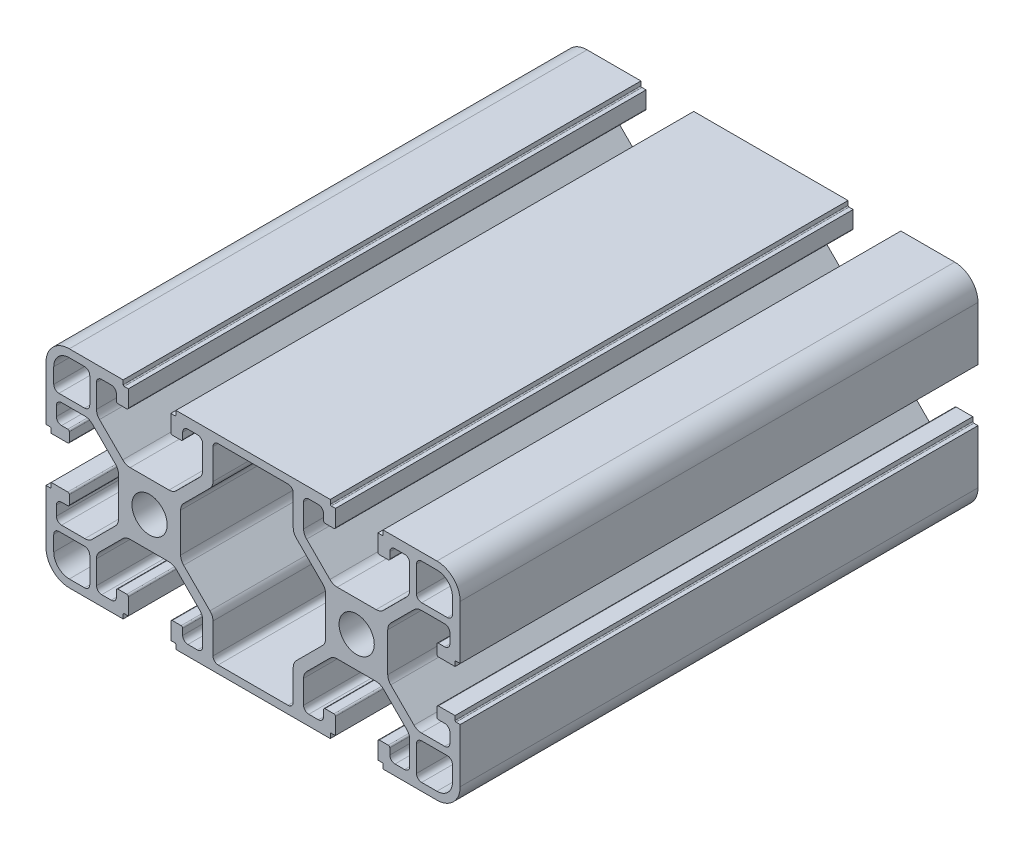
from build123d import *

# Parameters (mm, degrees)
SKETCH_1_R      = 3.4
EXTRUDE_1_DEPTH = 100


with BuildPart() as part:
    # 草图1 → 凸台-拉伸1 (new body)
    with BuildSketch(Plane.XY):
        with BuildLine():
            Line((-24.068782805, 18.940182328), (-34.468782805, 18.940182328))
            ThreePointArc((-34.468782805, 18.940182328), (-37.65076332, 17.622162844), (-38.968782805, 14.440182328))
            Line((-38.968782805, 14.440182328), (-38.968782805, 4.040182328))
            Line((-38.968782805, 4.040182328), (-38.168782805, 4.040182328))
            ThreePointArc((-38.168782805, 4.040182328), (-38.027361449, 3.981603684), (-37.968782805, 3.840182328))
            Line((-37.968782805, 3.840182328), (-37.968782805, 3.040182328))
            Line((-37.968782805, 3.040182328), (-34.768782805, 3.040182328))
            ThreePointArc((-34.768782805, 3.040182328), (-34.556650771, 3.128050294), (-34.468782805, 3.340182328))
            Line((-34.468782805, 3.340182328), (-34.468782805, 5.040182328))
            ThreePointArc((-34.468782805, 5.040182328), (-34.556650771, 5.252314363), (-34.768782805, 5.340182328))
            Line((-34.768782805, 5.340182328), (-35.968782805, 5.340182328))
            ThreePointArc((-35.968782805, 5.340182328), (-36.675889586, 5.633075547), (-36.968782805, 6.340182328))
            Line((-36.968782805, 6.340182328), (-36.968782805, 8.190182328))
            ThreePointArc((-36.968782805, 8.190182328), (-36.675889586, 8.897289109), (-35.968782805, 9.190182328))
            Line((-35.968782805, 9.190182328), (-31.461423492, 9.190182328))
            ThreePointArc((-31.461423492, 9.190182328), (-30.696056627, 9.037941393), (-30.04720993, 8.604395891))
            Line((-30.04720993, 8.604395891), (-25.554569243, 4.111755203))
            ThreePointArc((-25.554569243, 4.111755203), (-25.12102374, 3.462908506), (-24.968782805, 2.697541641))
            Line((-24.968782805, 2.697541641), (-24.968782805, -4.817176985))
            ThreePointArc((-24.968782805, -4.817176985), (-25.12102374, -5.582543849), (-25.554569243, -6.231390547))
            Line((-25.554569243, -6.231390547), (-30.04720993, -10.724031234))
            ThreePointArc((-30.04720993, -10.724031234), (-30.696056627, -11.157576737), (-31.461423492, -11.309817672))
            Line((-31.461423492, -11.309817672), (-35.968782805, -11.309817672))
            ThreePointArc((-35.968782805, -11.309817672), (-36.675889586, -11.016924453), (-36.968782805, -10.309817672))
            Line((-36.968782805, -10.309817672), (-36.968782805, -8.459817672))
            ThreePointArc((-36.968782805, -8.459817672), (-36.675889586, -7.752710891), (-35.968782805, -7.459817672))
            Line((-35.968782805, -7.459817672), (-34.768782805, -7.459817672))
            ThreePointArc((-34.768782805, -7.459817672), (-34.556650771, -7.371949706), (-34.468782805, -7.159817672))
            Line((-34.468782805, -7.159817672), (-34.468782805, -5.459817672))
            ThreePointArc((-34.468782805, -5.459817672), (-34.556650771, -5.247685637), (-34.768782805, -5.159817672))
            Line((-34.768782805, -5.159817672), (-37.968782805, -5.159817672))
            Line((-37.968782805, -5.159817672), (-37.968782805, -5.959817672))
            ThreePointArc((-37.968782805, -5.959817672), (-38.027361449, -6.101239028), (-38.168782805, -6.159817672))
            Line((-38.168782805, -6.159817672), (-38.968782805, -6.159817672))
            Line((-38.968782805, -6.159817672), (-38.968782805, -16.559817672))
            ThreePointArc((-38.968782805, -16.559817672), (-37.65076332, -19.741798187), (-34.468782805, -21.059817672))
            Line((-34.468782805, -21.059817672), (-24.068782805, -21.059817672))
            Line((-24.068782805, -21.059817672), (-24.068782805, -20.259817672))
            ThreePointArc((-24.068782805, -20.259817672), (-24.010204161, -20.118396316), (-23.868782805, -20.059817672))
            Line((-23.868782805, -20.059817672), (-23.068782805, -20.059817672))
            Line((-23.068782805, -20.059817672), (-23.068782805, -16.859817672))
            ThreePointArc((-23.068782805, -16.859817672), (-23.156650771, -16.647685637), (-23.368782805, -16.559817672))
            Line((-23.368782805, -16.559817672), (-25.068782805, -16.559817672))
            ThreePointArc((-25.068782805, -16.559817672), (-25.280914839, -16.647685637), (-25.368782805, -16.859817672))
            Line((-25.368782805, -16.859817672), (-25.368782805, -18.059817672))
            ThreePointArc((-25.368782805, -18.059817672), (-25.661676024, -18.766924453), (-26.368782805, -19.059817672))
            Line((-26.368782805, -19.059817672), (-28.218782805, -19.059817672))
            ThreePointArc((-28.218782805, -19.059817672), (-28.925889586, -18.766924453), (-29.218782805, -18.059817672))
            Line((-29.218782805, -18.059817672), (-29.218782805, -13.552458359))
            ThreePointArc((-29.218782805, -13.552458359), (-29.06654187, -12.787091494), (-28.632996367, -12.138244797))
            Line((-28.632996367, -12.138244797), (-24.14035568, -7.645604109))
            ThreePointArc((-24.14035568, -7.645604109), (-23.491508983, -7.212058607), (-22.726142118, -7.059817672))
            Line((-22.726142118, -7.059817672), (-15.211423492, -7.059817672))
            ThreePointArc((-15.211423492, -7.059817672), (-14.446056627, -7.212058607), (-13.79720993, -7.645604109))
            Line((-13.79720993, -7.645604109), (-9.304569243, -12.138244797))
            ThreePointArc((-9.304569243, -12.138244797), (-8.87102374, -12.787091494), (-8.718782805, -13.552458359))
            Line((-8.718782805, -13.552458359), (-8.718782805, -18.059817672))
            ThreePointArc((-8.718782805, -18.059817672), (-9.011676024, -18.766924453), (-9.718782805, -19.059817672))
            Line((-9.718782805, -19.059817672), (-11.568782805, -19.059817672))
            ThreePointArc((-11.568782805, -19.059817672), (-12.275889586, -18.766924453), (-12.568782805, -18.059817672))
            Line((-12.568782805, -18.059817672), (-12.568782805, -16.859817672))
            ThreePointArc((-12.568782805, -16.859817672), (-12.656650771, -16.647685637), (-12.868782805, -16.559817672))
            Line((-12.868782805, -16.559817672), (-14.568782805, -16.559817672))
            ThreePointArc((-14.568782805, -16.559817672), (-14.780914839, -16.647685637), (-14.868782805, -16.859817672))
            Line((-14.868782805, -16.859817672), (-14.868782805, -20.059817672))
            Line((-14.868782805, -20.059817672), (-14.068782805, -20.059817672))
            ThreePointArc((-14.068782805, -20.059817672), (-13.927361449, -20.118396316), (-13.868782805, -20.259817672))
            Line((-13.868782805, -20.259817672), (-13.868782805, -21.059817672))
            Line((-13.868782805, -21.059817672), (-3.468782805, -21.059817672))
            Line((-3.468782805, -21.059817672), (5.531217195, -21.059817672))
            Line((5.531217195, -21.059817672), (15.931217195, -21.059817672))
            Line((15.931217195, -21.059817672), (15.931217195, -20.259817672))
            ThreePointArc((15.931217195, -20.259817672), (15.989795839, -20.118396316), (16.131217195, -20.059817672))
            Line((16.131217195, -20.059817672), (16.931217195, -20.059817672))
            Line((16.931217195, -20.059817672), (16.931217195, -16.859817672))
            ThreePointArc((16.931217195, -16.859817672), (16.843349229, -16.647685637), (16.631217195, -16.559817672))
            Line((16.631217195, -16.559817672), (14.931217195, -16.559817672))
            ThreePointArc((14.931217195, -16.559817672), (14.719085161, -16.647685637), (14.631217195, -16.859817672))
            Line((14.631217195, -16.859817672), (14.631217195, -18.059817672))
            ThreePointArc((14.631217195, -18.059817672), (14.338323976, -18.766924453), (13.631217195, -19.059817672))
            Line((13.631217195, -19.059817672), (11.781217195, -19.059817672))
            ThreePointArc((11.781217195, -19.059817672), (11.074110414, -18.766924453), (10.781217195, -18.059817672))
            Line((10.781217195, -18.059817672), (10.781217195, -13.552458359))
            ThreePointArc((10.781217195, -13.552458359), (10.93345813, -12.787091494), (11.367003633, -12.138244797))
            Line((11.367003633, -12.138244797), (15.85964432, -7.645604109))
            ThreePointArc((15.85964432, -7.645604109), (16.508491017, -7.212058607), (17.273857882, -7.059817672))
            Line((17.273857882, -7.059817672), (24.788576508, -7.059817672))
            ThreePointArc((24.788576508, -7.059817672), (25.553943373, -7.212058607), (26.20279007, -7.645604109))
            Line((26.20279007, -7.645604109), (30.695430757, -12.138244797))
            ThreePointArc((30.695430757, -12.138244797), (31.12897626, -12.787091494), (31.281217195, -13.552458359))
            Line((31.281217195, -13.552458359), (31.281217195, -18.059817672))
            ThreePointArc((31.281217195, -18.059817672), (30.988323976, -18.766924453), (30.281217195, -19.059817672))
            Line((30.281217195, -19.059817672), (28.431217195, -19.059817672))
            ThreePointArc((28.431217195, -19.059817672), (27.724110414, -18.766924453), (27.431217195, -18.059817672))
            Line((27.431217195, -18.059817672), (27.431217195, -16.859817672))
            ThreePointArc((27.431217195, -16.859817672), (27.343349229, -16.647685637), (27.131217195, -16.559817672))
            Line((27.131217195, -16.559817672), (25.431217195, -16.559817672))
            ThreePointArc((25.431217195, -16.559817672), (25.219085161, -16.647685637), (25.131217195, -16.859817672))
            Line((25.131217195, -16.859817672), (25.131217195, -20.059817672))
            Line((25.131217195, -20.059817672), (25.931217195, -20.059817672))
            ThreePointArc((25.931217195, -20.059817672), (26.072638551, -20.118396316), (26.131217195, -20.259817672))
            Line((26.131217195, -20.259817672), (26.131217195, -21.059817672))
            Line((26.131217195, -21.059817672), (36.531217195, -21.059817672))
            ThreePointArc((36.531217195, -21.059817672), (39.71319771, -19.741798187), (41.031217195, -16.559817672))
            Line((41.031217195, -16.559817672), (41.031217195, -6.159817672))
            Line((41.031217195, -6.159817672), (40.231217195, -6.159817672))
            ThreePointArc((40.231217195, -6.159817672), (40.089795839, -6.101239028), (40.031217195, -5.959817672))
            Line((40.031217195, -5.959817672), (40.031217195, -5.159817672))
            Line((40.031217195, -5.159817672), (36.831217195, -5.159817672))
            ThreePointArc((36.831217195, -5.159817672), (36.619085161, -5.247685637), (36.531217195, -5.459817672))
            Line((36.531217195, -5.459817672), (36.531217195, -7.159817672))
            ThreePointArc((36.531217195, -7.159817672), (36.619085161, -7.371949706), (36.831217195, -7.459817672))
            Line((36.831217195, -7.459817672), (38.031217195, -7.459817672))
            ThreePointArc((38.031217195, -7.459817672), (38.738323976, -7.752710891), (39.031217195, -8.459817672))
            Line((39.031217195, -8.459817672), (39.031217195, -10.309817672))
            ThreePointArc((39.031217195, -10.309817672), (38.738323976, -11.016924453), (38.031217195, -11.309817672))
            Line((38.031217195, -11.309817672), (33.523857882, -11.309817672))
            ThreePointArc((33.523857882, -11.309817672), (32.758491017, -11.157576737), (32.10964432, -10.724031234))
            Line((32.10964432, -10.724031234), (27.617003633, -6.231390547))
            ThreePointArc((27.617003633, -6.231390547), (27.18345813, -5.582543849), (27.031217195, -4.817176985))
            Line((27.031217195, -4.817176985), (27.031217195, 2.697541641))
            ThreePointArc((27.031217195, 2.697541641), (27.18345813, 3.462908506), (27.617003633, 4.111755203))
            Line((27.617003633, 4.111755203), (32.10964432, 8.604395891))
            ThreePointArc((32.10964432, 8.604395891), (32.758491017, 9.037941393), (33.523857882, 9.190182328))
            Line((33.523857882, 9.190182328), (38.031217195, 9.190182328))
            ThreePointArc((38.031217195, 9.190182328), (38.738323976, 8.897289109), (39.031217195, 8.190182328))
            Line((39.031217195, 8.190182328), (39.031217195, 6.340182328))
            ThreePointArc((39.031217195, 6.340182328), (38.738323976, 5.633075547), (38.031217195, 5.340182328))
            Line((38.031217195, 5.340182328), (36.831217195, 5.340182328))
            ThreePointArc((36.831217195, 5.340182328), (36.619085161, 5.252314363), (36.531217195, 5.040182328))
            Line((36.531217195, 5.040182328), (36.531217195, 3.340182328))
            ThreePointArc((36.531217195, 3.340182328), (36.619085161, 3.128050294), (36.831217195, 3.040182328))
            Line((36.831217195, 3.040182328), (40.031217195, 3.040182328))
            Line((40.031217195, 3.040182328), (40.031217195, 3.840182328))
            ThreePointArc((40.031217195, 3.840182328), (40.089795839, 3.981603684), (40.231217195, 4.040182328))
            Line((40.231217195, 4.040182328), (41.031217195, 4.040182328))
            Line((41.031217195, 4.040182328), (41.031217195, 14.440182328))
            ThreePointArc((41.031217195, 14.440182328), (39.71319771, 17.622162844), (36.531217195, 18.940182328))
            Line((36.531217195, 18.940182328), (26.131217195, 18.940182328))
            Line((26.131217195, 18.940182328), (26.131217195, 18.140182328))
            ThreePointArc((26.131217195, 18.140182328), (26.072638551, 17.998760972), (25.931217195, 17.940182328))
            Line((25.931217195, 17.940182328), (25.131217195, 17.940182328))
            Line((25.131217195, 17.940182328), (25.131217195, 14.740182328))
            ThreePointArc((25.131217195, 14.740182328), (25.219085161, 14.528050294), (25.431217195, 14.440182328))
            Line((25.431217195, 14.440182328), (27.131217195, 14.440182328))
            ThreePointArc((27.131217195, 14.440182328), (27.343349229, 14.528050294), (27.431217195, 14.740182328))
            Line((27.431217195, 14.740182328), (27.431217195, 15.940182328))
            ThreePointArc((27.431217195, 15.940182328), (27.724110414, 16.647289109), (28.431217195, 16.940182328))
            Line((28.431217195, 16.940182328), (30.281217195, 16.940182328))
            ThreePointArc((30.281217195, 16.940182328), (30.988323976, 16.647289109), (31.281217195, 15.940182328))
            Line((31.281217195, 15.940182328), (31.281217195, 11.432823015))
            ThreePointArc((31.281217195, 11.432823015), (31.12897626, 10.667456151), (30.695430757, 10.018609453))
            Line((30.695430757, 10.018609453), (26.20279007, 5.525968766))
            ThreePointArc((26.20279007, 5.525968766), (25.553943373, 5.092423263), (24.788576508, 4.940182328))
            Line((24.788576508, 4.940182328), (17.273857882, 4.940182328))
            ThreePointArc((17.273857882, 4.940182328), (16.508491017, 5.092423263), (15.85964432, 5.525968766))
            Line((15.85964432, 5.525968766), (11.367003633, 10.018609453))
            ThreePointArc((11.367003633, 10.018609453), (10.93345813, 10.667456151), (10.781217195, 11.432823015))
            Line((10.781217195, 11.432823015), (10.781217195, 15.940182328))
            ThreePointArc((10.781217195, 15.940182328), (11.074110414, 16.647289109), (11.781217195, 16.940182328))
            Line((11.781217195, 16.940182328), (13.631217195, 16.940182328))
            ThreePointArc((13.631217195, 16.940182328), (14.338323976, 16.647289109), (14.631217195, 15.940182328))
            Line((14.631217195, 15.940182328), (14.631217195, 14.740182328))
            ThreePointArc((14.631217195, 14.740182328), (14.719085161, 14.528050294), (14.931217195, 14.440182328))
            Line((14.931217195, 14.440182328), (16.631217195, 14.440182328))
            ThreePointArc((16.631217195, 14.440182328), (16.843349229, 14.528050294), (16.931217195, 14.740182328))
            Line((16.931217195, 14.740182328), (16.931217195, 17.940182328))
            Line((16.931217195, 17.940182328), (16.131217195, 17.940182328))
            ThreePointArc((16.131217195, 17.940182328), (15.989795839, 17.998760972), (15.931217195, 18.140182328))
            Line((15.931217195, 18.140182328), (15.931217195, 18.940182328))
            Line((15.931217195, 18.940182328), (5.531217195, 18.940182328))
            Line((5.531217195, 18.940182328), (-3.468782805, 18.940182328))
            Line((-3.468782805, 18.940182328), (-13.868782805, 18.940182328))
            Line((-13.868782805, 18.940182328), (-13.868782805, 18.140182328))
            ThreePointArc((-13.868782805, 18.140182328), (-13.927361449, 17.998760972), (-14.068782805, 17.940182328))
            Line((-14.068782805, 17.940182328), (-14.868782805, 17.940182328))
            Line((-14.868782805, 17.940182328), (-14.868782805, 14.740182328))
            ThreePointArc((-14.868782805, 14.740182328), (-14.780914839, 14.528050294), (-14.568782805, 14.440182328))
            Line((-14.568782805, 14.440182328), (-12.868782805, 14.440182328))
            ThreePointArc((-12.868782805, 14.440182328), (-12.656650771, 14.528050294), (-12.568782805, 14.740182328))
            Line((-12.568782805, 14.740182328), (-12.568782805, 15.940182328))
            ThreePointArc((-12.568782805, 15.940182328), (-12.275889586, 16.647289109), (-11.568782805, 16.940182328))
            Line((-11.568782805, 16.940182328), (-9.718782805, 16.940182328))
            ThreePointArc((-9.718782805, 16.940182328), (-9.011676024, 16.647289109), (-8.718782805, 15.940182328))
            Line((-8.718782805, 15.940182328), (-8.718782805, 11.432823015))
            ThreePointArc((-8.718782805, 11.432823015), (-8.87102374, 10.667456151), (-9.304569243, 10.018609453))
            Line((-9.304569243, 10.018609453), (-13.79720993, 5.525968766))
            ThreePointArc((-13.79720993, 5.525968766), (-14.446056627, 5.092423263), (-15.211423492, 4.940182328))
            Line((-15.211423492, 4.940182328), (-22.726142118, 4.940182328))
            ThreePointArc((-22.726142118, 4.940182328), (-23.491508983, 5.092423263), (-24.14035568, 5.525968766))
            Line((-24.14035568, 5.525968766), (-28.632996367, 10.018609453))
            ThreePointArc((-28.632996367, 10.018609453), (-29.06654187, 10.667456151), (-29.218782805, 11.432823015))
            Line((-29.218782805, 11.432823015), (-29.218782805, 15.940182328))
            ThreePointArc((-29.218782805, 15.940182328), (-28.925889586, 16.647289109), (-28.218782805, 16.940182328))
            Line((-28.218782805, 16.940182328), (-26.368782805, 16.940182328))
            ThreePointArc((-26.368782805, 16.940182328), (-25.661676024, 16.647289109), (-25.368782805, 15.940182328))
            Line((-25.368782805, 15.940182328), (-25.368782805, 14.740182328))
            ThreePointArc((-25.368782805, 14.740182328), (-25.280914839, 14.528050294), (-25.068782805, 14.440182328))
            Line((-25.068782805, 14.440182328), (-23.368782805, 14.440182328))
            ThreePointArc((-23.368782805, 14.440182328), (-23.156650771, 14.528050294), (-23.068782805, 14.740182328))
            Line((-23.068782805, 14.740182328), (-23.068782805, 17.940182328))
            Line((-23.068782805, 17.940182328), (-23.868782805, 17.940182328))
            ThreePointArc((-23.868782805, 17.940182328), (-24.010204161, 17.998760972), (-24.068782805, 18.140182328))
            Line((-24.068782805, 18.140182328), (-24.068782805, 18.940182328))
        make_face()
        with Locations((-18.968782805, -1.059817672)):
            Circle(SKETCH_1_R, mode=Mode.SUBTRACT)
        with Locations((21.031217195, -1.059817672)):
            Circle(SKETCH_1_R, mode=Mode.SUBTRACT)
        with BuildLine():
            Line((-12.968782805, 2.697541641), (-12.968782805, -4.817176985))
            ThreePointArc((-12.968782805, -4.817176985), (-12.81654187, -5.582543849), (-12.382996367, -6.231390547))
            Line((-12.382996367, -6.231390547), (-7.304569243, -11.309817672))
            ThreePointArc((-7.304569243, -11.309817672), (-6.87102374, -11.958664369), (-6.718782805, -12.724031234))
            Line((-6.718782805, -12.724031234), (-6.718782805, -18.563817672))
            ThreePointArc((-6.718782805, -18.563817672), (-6.425889586, -19.270924453), (-5.718782805, -19.563817672))
            Line((-5.718782805, -19.563817672), (7.781217195, -19.563817672))
            ThreePointArc((7.781217195, -19.563817672), (8.488323976, -19.270924453), (8.781217195, -18.563817672))
            Line((8.781217195, -18.563817672), (8.781217195, -12.724031234))
            ThreePointArc((8.781217195, -12.724031234), (8.93345813, -11.958664369), (9.367003633, -11.309817672))
            Line((9.367003633, -11.309817672), (14.445430757, -6.231390547))
            ThreePointArc((14.445430757, -6.231390547), (14.87897626, -5.582543849), (15.031217195, -4.817176985))
            Line((15.031217195, -4.817176985), (15.031217195, 2.697541641))
            ThreePointArc((15.031217195, 2.697541641), (14.87897626, 3.462908506), (14.445430757, 4.111755203))
            Line((14.445430757, 4.111755203), (9.367003633, 9.190182328))
            ThreePointArc((9.367003633, 9.190182328), (8.93345813, 9.839029026), (8.781217195, 10.604395891))
            Line((8.781217195, 10.604395891), (8.781217195, 16.444182328))
            ThreePointArc((8.781217195, 16.444182328), (8.488323976, 17.151289109), (7.781217195, 17.444182328))
            Line((7.781217195, 17.444182328), (-5.718782805, 17.444182328))
            ThreePointArc((-5.718782805, 17.444182328), (-6.425889586, 17.151289109), (-6.718782805, 16.444182328))
            Line((-6.718782805, 16.444182328), (-6.718782805, 10.604395891))
            ThreePointArc((-6.718782805, 10.604395891), (-6.87102374, 9.839029026), (-7.304569243, 9.190182328))
            Line((-7.304569243, 9.190182328), (-12.382996367, 4.111755203))
            ThreePointArc((-12.382996367, 4.111755203), (-12.81654187, 3.462908506), (-12.968782805, 2.697541641))
        make_face(mode=Mode.SUBTRACT)
        with BuildLine():
            Line((-37.472782805, 14.444182328), (-37.472782805, 11.490182328))
            ThreePointArc((-37.472782805, 11.490182328), (-37.179889586, 10.783075547), (-36.472782805, 10.490182328))
            Line((-36.472782805, 10.490182328), (-31.518782805, 10.490182328))
            ThreePointArc((-31.518782805, 10.490182328), (-30.811676024, 10.783075547), (-30.518782805, 11.490182328))
            Line((-30.518782805, 11.490182328), (-30.518782805, 16.444182328))
            ThreePointArc((-30.518782805, 16.444182328), (-30.811676024, 17.151289109), (-31.518782805, 17.444182328))
            Line((-31.518782805, 17.444182328), (-34.472782805, 17.444182328))
            ThreePointArc((-34.472782805, 17.444182328), (-36.594103149, 16.565502672), (-37.472782805, 14.444182328))
        make_face(mode=Mode.SUBTRACT)
        with BuildLine():
            Line((-37.472782805, -16.563817672), (-37.472782805, -13.609817672))
            ThreePointArc((-37.472782805, -13.609817672), (-37.179889586, -12.902710891), (-36.472782805, -12.609817672))
            Line((-36.472782805, -12.609817672), (-31.518782805, -12.609817672))
            ThreePointArc((-31.518782805, -12.609817672), (-30.811676024, -12.902710891), (-30.518782805, -13.609817672))
            Line((-30.518782805, -13.609817672), (-30.518782805, -18.563817672))
            ThreePointArc((-30.518782805, -18.563817672), (-30.811676024, -19.270924453), (-31.518782805, -19.563817672))
            Line((-31.518782805, -19.563817672), (-34.472782805, -19.563817672))
            ThreePointArc((-34.472782805, -19.563817672), (-36.594103149, -18.685138015), (-37.472782805, -16.563817672))
        make_face(mode=Mode.SUBTRACT)
        with BuildLine():
            Line((33.581217195, -12.609817672), (38.535217195, -12.609817672))
            ThreePointArc((38.535217195, -12.609817672), (39.242323976, -12.902710891), (39.535217195, -13.609817672))
            Line((39.535217195, -13.609817672), (39.535217195, -16.563817672))
            ThreePointArc((39.535217195, -16.563817672), (38.656537538, -18.685138015), (36.535217195, -19.563817672))
            Line((36.535217195, -19.563817672), (33.581217195, -19.563817672))
            ThreePointArc((33.581217195, -19.563817672), (32.874110414, -19.270924453), (32.581217195, -18.563817672))
            Line((32.581217195, -18.563817672), (32.581217195, -13.609817672))
            ThreePointArc((32.581217195, -13.609817672), (32.874110414, -12.902710891), (33.581217195, -12.609817672))
        make_face(mode=Mode.SUBTRACT)
        with BuildLine():
            Line((32.581217195, 11.490182328), (32.581217195, 16.444182328))
            ThreePointArc((32.581217195, 16.444182328), (32.874110414, 17.151289109), (33.581217195, 17.444182328))
            Line((33.581217195, 17.444182328), (36.535217195, 17.444182328))
            ThreePointArc((36.535217195, 17.444182328), (38.656537538, 16.565502672), (39.535217195, 14.444182328))
            Line((39.535217195, 14.444182328), (39.535217195, 11.490182328))
            ThreePointArc((39.535217195, 11.490182328), (39.242323976, 10.783075547), (38.535217195, 10.490182328))
            Line((38.535217195, 10.490182328), (33.581217195, 10.490182328))
            ThreePointArc((33.581217195, 10.490182328), (32.874110414, 10.783075547), (32.581217195, 11.490182328))
        make_face(mode=Mode.SUBTRACT)
    extrude(amount=EXTRUDE_1_DEPTH)


solid = part.part
